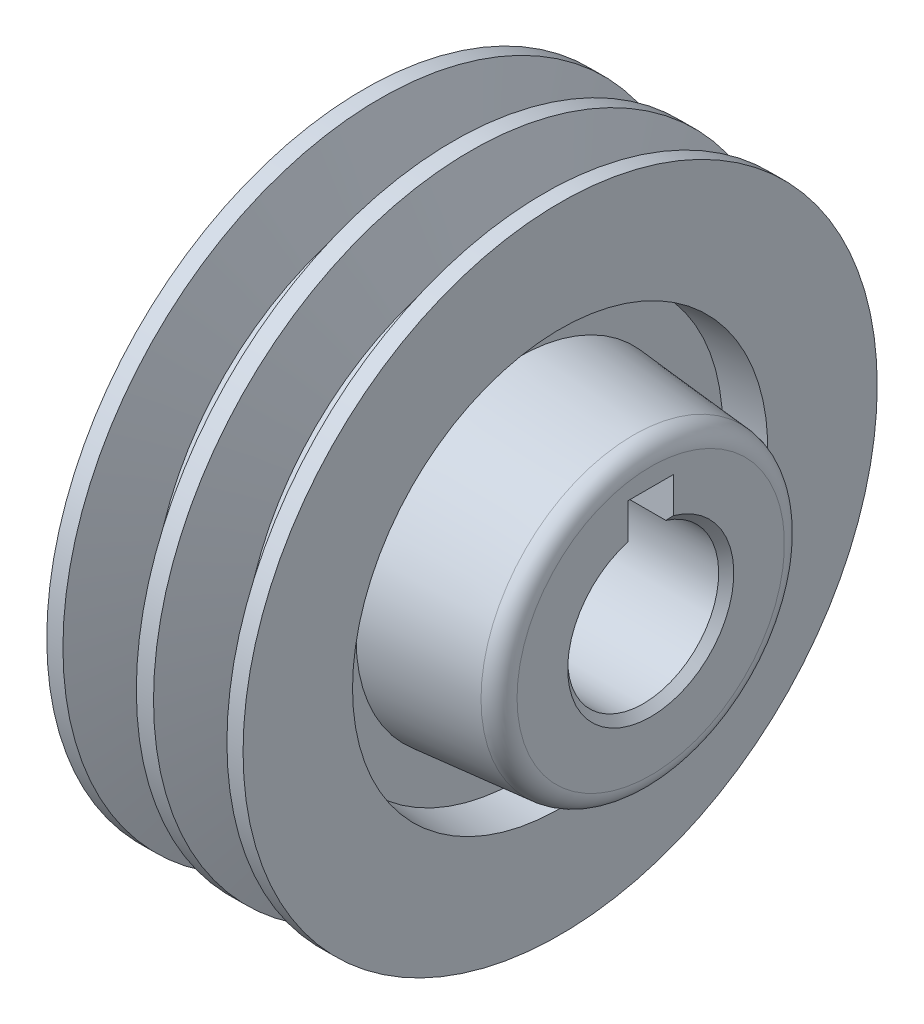
from build123d import *

# Parameters (mm, degrees)
PATTERN_LINEAR_951_COUNT = 2
PATTERN_LINEAR_951_PITCH = 12
CHAMFER_1_SIZE           = 1
SKETCH_4_W               = 6
SKETCH_4_H               = 5.760607938
CUT_EXTRUDE_1_DEPTH      = 78.640195775
FILLET_2_R               = 2.5


with BuildPart() as part:
    # 草图1 → 旋转1 (revolve)
    with BuildSketch(Plane.XY, mode=Mode.PRIVATE) as revolve_1_sk:
        Polygon((-12, 10), (-12, 20), (5.5, 21.531051612), (5.5, 27.018812351), (0, 27.5), (0, 42), (26, 42), (26, 27.5), (20.5, 27.018812351), (20.5, 21.531051612), (38, 20), (38, 10), align=None)
    revolve(revolve_1_sk.sketch.rotate(Axis((0, 0, 0), (1, 0, 0)), 90), axis=Axis((0, 0, 0), (1, 0, 0)))

    # 草图2 → 切除-旋转1 (revolve, cut)
    with BuildSketch(Plane.XY, mode=Mode.PRIVATE) as cut_revolve_1_sk:
        Polygon((9.10988523, 33), (11.861461363, 42), (2.138538637, 42), (4.89011477, 33), align=None)
    cut_revolve_1 = revolve(cut_revolve_1_sk.sketch.rotate(Axis((0, 0, 0), (1, 0, 0)), 90), axis=Axis((0, 0, 0), (1, 0, 0)), mode=Mode.SUBTRACT)

    # Pattern Linear 951: 切除-旋转1 ×2
    with Locations(*[(i * PATTERN_LINEAR_951_PITCH, 0, 0) for i in range(1, PATTERN_LINEAR_951_COUNT)]):
        add(cut_revolve_1, mode=Mode.SUBTRACT)

    # 倒角1
    chamfer_1_edges = [part.edges().sort_by_distance(p)[0] for p in [
        (-12, 0, -10),
        (38, 0, -10),
    ]]
    chamfer(chamfer_1_edges, length=CHAMFER_1_SIZE)

    # 草图4 → 切除-拉伸1 (cut, through all)
    with BuildSketch(Plane.ZY.offset(12)):
        with Locations((0, 12.419695983)):
            Rectangle(SKETCH_4_W, SKETCH_4_H)
    extrude(amount=-CUT_EXTRUDE_1_DEPTH, mode=Mode.SUBTRACT)

    # 圆角2
    fillet_2_edges = [part.edges().sort_by_distance(p)[0] for p in [
        (-12, 0, -20),
        (38, 0, -20),
    ]]
    fillet(fillet_2_edges, radius=FILLET_2_R)


solid = part.part
